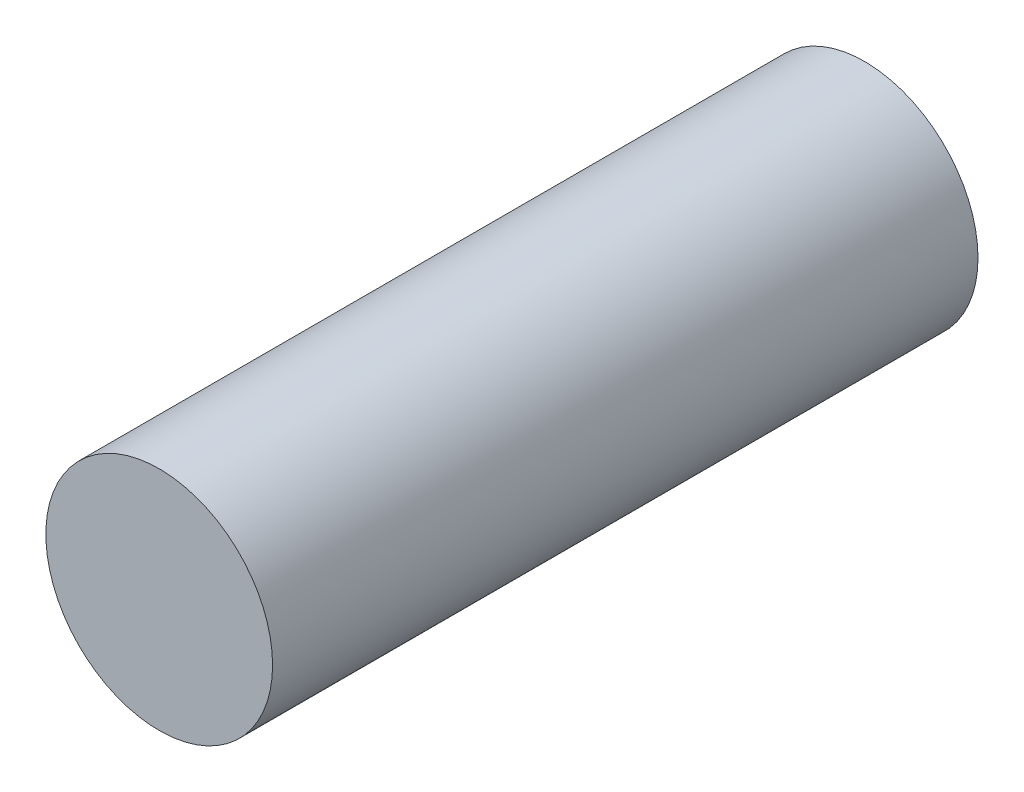
from build123d import *

# Parameters (mm, degrees)
SKETCH1_R           = 4.5
BOSS_EXTRUDE1_DEPTH = 28


with BuildPart() as part:
    # Sketch1 → Boss-Extrude1 (new body)
    with BuildSketch(Plane.XY):
        Circle(SKETCH1_R)
    extrude(amount=BOSS_EXTRUDE1_DEPTH)


solid = part.part
